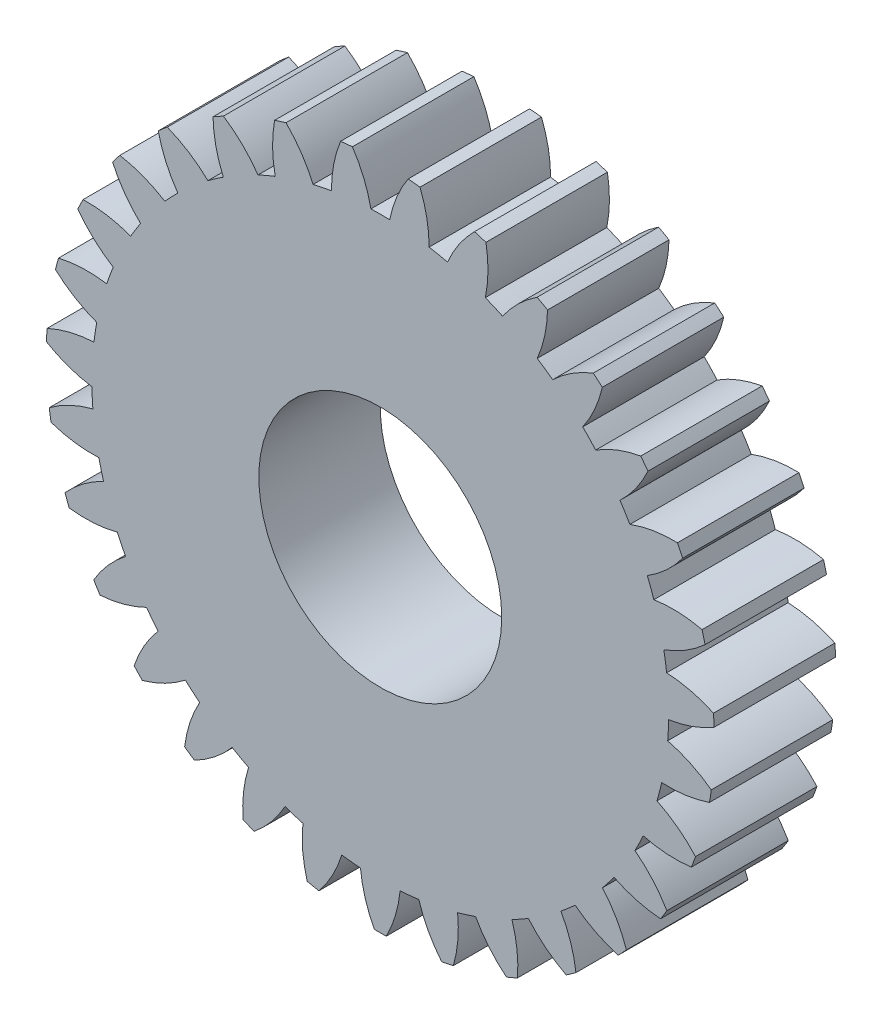
from build123d import *

# Parameters (mm, degrees)
SKETCH_1_R      = 3
EXTRUDE_1_DEPTH = 3


with BuildPart() as part:
    # 草图1 → 凸台-拉伸1 (new body)
    with BuildSketch(Plane.XY):
        with BuildLine():
            ThreePointArc((7.122832774, -0.128954515), (7.703578069, 0.016376255), (8.245560205, 0.270623168))
            ThreePointArc((8.245560205, 0.270623168), (8.239411184, 0.417855643), (8.230633394, 0.564954801))
            ThreePointArc((8.230633394, 0.564954801), (7.665710259, 0.763065833), (7.073241711, 0.848897931))
            ThreePointArc((7.073241711, 0.848897931), (7.041848343, 1.078771487), (7.002986322, 1.307500888))
            ThreePointArc((7.002986322, 1.307500888), (7.542588857, 1.566759896), (8.02229706, 1.924902563))
            ThreePointArc((8.02229706, 1.924902563), (7.986636231, 2.067883391), (7.94842728, 2.210204465))
            ThreePointArc((7.94842728, 2.210204465), (7.355188697, 2.290541961), (6.757570141, 2.255354029))
            ThreePointArc((6.757570141, 2.255354029), (6.680546189, 2.474202621), (6.596436787, 2.690427051))
            ThreePointArc((6.596436787, 2.690427051), (7.072805172, 3.053000204), (7.470600131, 3.50037622))
            ThreePointArc((7.470600131, 3.50037622), (7.406887451, 3.63325175), (7.340811619, 3.764968098))
            ThreePointArc((7.340811619, 3.764968098), (6.743544845, 3.724243032), (6.165242855, 3.569475668))
            ThreePointArc((6.165242855, 3.569475668), (6.04574169, 3.76833961), (5.919828355, 3.963206814))
            ThreePointArc((5.919828355, 3.963206814), (6.313460012, 4.414250324), (6.613055954, 4.932544064))
            ThreePointArc((6.613055954, 4.932544064), (6.52389983, 5.049874356), (6.432662267, 5.165593495))
            ThreePointArc((6.432662267, 5.165593495), (5.855819475, 5.005473156), (5.320509802, 4.737462554))
            ThreePointArc((5.320509802, 4.737462554), (5.163423816, 4.908200331), (5.000861454, 5.073732425))
            ThreePointArc((5.000861454, 5.073732425), (5.295641057, 5.594780518), (5.48477249, 6.162772974))
            ThreePointArc((5.48477249, 6.162772974), (5.373822982, 6.259754512), (5.261158967, 6.354738887))
            ThreePointArc((5.261158967, 6.354738887), (4.728356168, 6.081778621), (4.257954452, 5.711497166))
            ThreePointArc((4.257954452, 5.711497166), (4.069714764, 5.847118755), (3.877158698, 5.976538834))
            ThreePointArc((3.877158698, 5.976538834), (4.061017935, 6.54625974), (4.131941796, 7.140697235))
            ThreePointArc((4.131941796, 7.140697235), (4.003741191, 7.213359583), (3.8742632, 7.283720523))
            ThreePointArc((3.8742632, 7.283720523), (3.407313403, 6.909095354), (3.021077947, 6.451702414))
            ThreePointArc((3.021077947, 6.451702414), (2.809391112, 6.54665545), (2.594724609, 6.634665041))
            ThreePointArc((2.594724609, 6.634665041), (2.660136261, 7.229734318), (2.609948919, 7.826280511))
            ThreePointArc((2.609948919, 7.826280511), (2.469745765, 7.871648865), (2.328754643, 7.914505785))
            ThreePointArc((2.328754643, 7.914505785), (1.946774828, 7.453552912), (1.660518156, 6.927774206))
            ThreePointArc((1.660518156, 6.927774206), (1.434050657, 6.978171301), (1.20606219, 7.021167281))
            ThreePointArc((1.20606219, 7.021167281), (1.150348297, 7.617222725), (0.981104426, 8.191454944))
            ThreePointArc((0.981104426, 8.191454944), (0.834638656, 8.207671918), (0.687906597, 8.221270249))
            ThreePointArc((0.687906597, 8.221270249), (0.406535062, 7.692861138), (0.231976557, 7.120222109))
            ThreePointArc((0.231976557, 7.120222109), (0, 7.124), (-0.231976557, 7.120222109))
            ThreePointArc((-0.231976557, 7.120222109), (-0.406535062, 7.692861138), (-0.687906597, 8.221270249))
            ThreePointArc((-0.687906597, 8.221270249), (-0.834638656, 8.207671918), (-0.981104426, 8.191454944))
            ThreePointArc((-0.981104426, 8.191454944), (-1.150348297, 7.617222725), (-1.20606219, 7.021167281))
            ThreePointArc((-1.20606219, 7.021167281), (-1.434050657, 6.978171301), (-1.660518156, 6.927774206))
            ThreePointArc((-1.660518156, 6.927774206), (-1.946774828, 7.453552912), (-2.328754643, 7.914505785))
            ThreePointArc((-2.328754643, 7.914505785), (-2.469745765, 7.871648865), (-2.609948919, 7.826280511))
            ThreePointArc((-2.609948919, 7.826280511), (-2.660136261, 7.229734318), (-2.594724609, 6.634665041))
            ThreePointArc((-2.594724609, 6.634665041), (-2.809391112, 6.54665545), (-3.021077947, 6.451702414))
            ThreePointArc((-3.021077947, 6.451702414), (-3.407313403, 6.909095354), (-3.8742632, 7.283720523))
            ThreePointArc((-3.8742632, 7.283720523), (-4.003741191, 7.213359583), (-4.131941796, 7.140697235))
            ThreePointArc((-4.131941796, 7.140697235), (-4.061017935, 6.54625974), (-3.877158698, 5.976538834))
            ThreePointArc((-3.877158698, 5.976538834), (-4.069714764, 5.847118755), (-4.257954452, 5.711497166))
            ThreePointArc((-4.257954452, 5.711497166), (-4.728356168, 6.081778621), (-5.261158967, 6.354738887))
            ThreePointArc((-5.261158967, 6.354738887), (-5.373822982, 6.259754512), (-5.48477249, 6.162772974))
            ThreePointArc((-5.48477249, 6.162772974), (-5.295641057, 5.594780518), (-5.000861454, 5.073732425))
            ThreePointArc((-5.000861454, 5.073732425), (-5.163423816, 4.908200331), (-5.320509802, 4.737462554))
            ThreePointArc((-5.320509802, 4.737462554), (-5.855819475, 5.005473156), (-6.432662267, 5.165593495))
            ThreePointArc((-6.432662267, 5.165593495), (-6.52389983, 5.049874356), (-6.613055954, 4.932544064))
            ThreePointArc((-6.613055954, 4.932544064), (-6.313460012, 4.414250324), (-5.919828355, 3.963206814))
            ThreePointArc((-5.919828355, 3.963206814), (-6.04574169, 3.76833961), (-6.165242855, 3.569475668))
            ThreePointArc((-6.165242855, 3.569475668), (-6.743544845, 3.724243032), (-7.340811619, 3.764968098))
            ThreePointArc((-7.340811619, 3.764968098), (-7.406887451, 3.63325175), (-7.470600131, 3.50037622))
            ThreePointArc((-7.470600131, 3.50037622), (-7.072805172, 3.053000204), (-6.596436787, 2.690427051))
            ThreePointArc((-6.596436787, 2.690427051), (-6.680546189, 2.474202621), (-6.757570141, 2.255354029))
            ThreePointArc((-6.757570141, 2.255354029), (-7.355188697, 2.290541961), (-7.94842728, 2.210204465))
            ThreePointArc((-7.94842728, 2.210204465), (-7.986636231, 2.067883391), (-8.02229706, 1.924902563))
            ThreePointArc((-8.02229706, 1.924902563), (-7.542588857, 1.566759896), (-7.002986322, 1.307500888))
            ThreePointArc((-7.002986322, 1.307500888), (-7.041848343, 1.078771487), (-7.073241711, 0.848897931))
            ThreePointArc((-7.073241711, 0.848897931), (-7.665710259, 0.763065833), (-8.230633394, 0.564954801))
            ThreePointArc((-8.230633394, 0.564954801), (-8.239411184, 0.417855643), (-8.245560205, 0.270623168))
            ThreePointArc((-8.245560205, 0.270623168), (-7.703578069, 0.016376255), (-7.122832774, -0.128954515))
            ThreePointArc((-7.122832774, -0.128954515), (-7.114856397, -0.360824679), (-7.099333935, -0.592312149))
            ThreePointArc((-7.099333935, -0.592312149), (-7.662396743, -0.7956503), (-8.175876411, -1.103424178))
            ThreePointArc((-8.175876411, -1.103424178), (-8.154863676, -1.249279164), (-8.131249147, -1.39473557))
            ThreePointArc((-8.131249147, -1.39473557), (-7.549181889, -1.534677833), (-6.951069616, -1.560130505))
            ThreePointArc((-6.951069616, -1.560130505), (-6.896581395, -1.78564864), (-6.834778593, -2.009272899))
            ThreePointArc((-6.834778593, -2.009272899), (-7.345383803, -2.321792416), (-7.786398086, -2.726628842))
            ThreePointArc((-7.786398086, -2.726628842), (-7.73645509, -2.865268336), (-7.684043793, -3.002993671))
            ThreePointArc((-7.684043793, -3.002993671), (-7.085721316, -3.02290203), (-6.494728851, -2.927434568))
            ThreePointArc((-6.494728851, -2.927434568), (-6.39595954, -3.137367936), (-6.290406613, -3.34397378))
            ThreePointArc((-6.290406613, -3.34397378), (-6.727649988, -3.752880078), (-7.078143709, -4.238205001))
            ThreePointArc((-7.078143709, -4.238205001), (-7.001315124, -4.363953085), (-6.922252783, -4.488308858))
            ThreePointArc((-6.922252783, -4.488308858), (-6.332170479, -4.387368262), (-5.772493124, -4.174889117))
            ThreePointArc((-5.772493124, -4.174889117), (-5.63348635, -4.36064302), (-5.488504647, -4.541771983))
            ThreePointArc((-5.488504647, -4.541771983), (-5.834485392, -5.030324389), (-6.080109297, -5.57626855))
            ThreePointArc((-6.080109297, -5.57626855), (-5.979540495, -5.683977082), (-5.877063931, -5.789872153))
            ThreePointArc((-5.877063931, -5.789872153), (-5.319379839, -5.572215122), (-4.813930849, -5.251423214))
            ThreePointArc((-4.813930849, -5.251423214), (-4.640377567, -5.405392866), (-4.461902656, -5.553629506))
            ThreePointArc((-4.461902656, -5.553629506), (-4.702456278, -6.101826628), (-4.833154496, -6.686039008))
            ThreePointArc((-4.833154496, -6.686039008), (-4.712962775, -6.77129839), (-4.591267391, -6.854397402))
            ThreePointArc((-4.591267391, -6.854397402), (-4.088813164, -6.528934841), (-3.658285681, -6.112963429))
            ThreePointArc((-3.658285681, -6.112963429), (-3.457291181, -6.228845293), (-3.252629845, -6.338120785))
            ThreePointArc((-3.252629845, -6.338120785), (-3.377908052, -6.923519368), (-3.388329782, -7.522082244))
            ThreePointArc((-3.388329782, -7.522082244), (-3.253435805, -7.581401946), (-3.117503825, -7.638302815))
            ThreePointArc((-3.117503825, -7.638302815), (-2.690849997, -7.2183592), (-2.352869866, -6.724238202))
            ThreePointArc((-2.352869866, -6.724238202), (-2.132662888, -6.797288063), (-1.910193987, -6.863128655))
            ThreePointArc((-1.910193987, -6.863128655), (-1.915067873, -7.461762412), (-1.804786448, -8.05017055))
            ThreePointArc((-1.804786448, -8.05017055), (-1.660712791, -8.081122015), (-1.516109286, -8.109495214))
            ThreePointArc((-1.516109286, -8.109495214), (-1.182723115, -7.612263085), (-0.951127283, -7.060221873))
            ThreePointArc((-0.951127283, -7.060221873), (-0.720723126, -7.08744906), (-0.489554563, -7.107159231))
            ThreePointArc((-0.489554563, -7.107159231), (-0.37382459, -7.694520025), (-0.147354945, -8.248683927))
            ThreePointArc((-0.147354945, -8.248683927), (0, -8.25), (0.147354945, -8.248683927))
            ThreePointArc((0.147354945, -8.248683927), (0.37382459, -7.694520025), (0.489554563, -7.107159231))
            ThreePointArc((0.489554563, -7.107159231), (0.720723126, -7.08744906), (0.951127283, -7.060221873))
            ThreePointArc((0.951127283, -7.060221873), (1.182723115, -7.612263085), (1.516109286, -8.109495214))
            ThreePointArc((1.516109286, -8.109495214), (1.660712791, -8.081122015), (1.804786448, -8.05017055))
            ThreePointArc((1.804786448, -8.05017055), (1.915067873, -7.461762412), (1.910193987, -6.863128655))
            ThreePointArc((1.910193987, -6.863128655), (2.132662888, -6.797288063), (2.352869866, -6.724238202))
            ThreePointArc((2.352869866, -6.724238202), (2.690849997, -7.2183592), (3.117503825, -7.638302815))
            ThreePointArc((3.117503825, -7.638302815), (3.253435805, -7.581401946), (3.388329782, -7.522082244))
            ThreePointArc((3.388329782, -7.522082244), (3.377908052, -6.923519368), (3.252629845, -6.338120785))
            ThreePointArc((3.252629845, -6.338120785), (3.457291181, -6.228845293), (3.658285681, -6.112963429))
            ThreePointArc((3.658285681, -6.112963429), (4.088813164, -6.528934841), (4.591267391, -6.854397402))
            ThreePointArc((4.591267391, -6.854397402), (4.712962775, -6.77129839), (4.833154496, -6.686039008))
            ThreePointArc((4.833154496, -6.686039008), (4.702456278, -6.101826628), (4.461902656, -5.553629506))
            ThreePointArc((4.461902656, -5.553629506), (4.640377567, -5.405392866), (4.813930849, -5.251423214))
            ThreePointArc((4.813930849, -5.251423214), (5.319379839, -5.572215122), (5.877063931, -5.789872153))
            ThreePointArc((5.877063931, -5.789872153), (5.979540495, -5.683977082), (6.080109297, -5.57626855))
            ThreePointArc((6.080109297, -5.57626855), (5.834485392, -5.030324389), (5.488504647, -4.541771983))
            ThreePointArc((5.488504647, -4.541771983), (5.63348635, -4.36064302), (5.772493124, -4.174889117))
            ThreePointArc((5.772493124, -4.174889117), (6.332170479, -4.387368262), (6.922252783, -4.488308858))
            ThreePointArc((6.922252783, -4.488308858), (7.001315124, -4.363953085), (7.078143709, -4.238205001))
            ThreePointArc((7.078143709, -4.238205001), (6.727649988, -3.752880078), (6.290406613, -3.34397378))
            ThreePointArc((6.290406613, -3.34397378), (6.39595954, -3.137367936), (6.494728851, -2.927434568))
            ThreePointArc((6.494728851, -2.927434568), (7.085721316, -3.02290203), (7.684043793, -3.002993671))
            ThreePointArc((7.684043793, -3.002993671), (7.73645509, -2.865268336), (7.786398086, -2.726628842))
            ThreePointArc((7.786398086, -2.726628842), (7.345383803, -2.321792416), (6.834778593, -2.009272899))
            ThreePointArc((6.834778593, -2.009272899), (6.896581395, -1.78564864), (6.951069616, -1.560130505))
            ThreePointArc((6.951069616, -1.560130505), (7.549181889, -1.534677833), (8.131249147, -1.39473557))
            ThreePointArc((8.131249147, -1.39473557), (8.154863676, -1.249279164), (8.175876411, -1.103424178))
            ThreePointArc((8.175876411, -1.103424178), (7.662396743, -0.7956503), (7.099333935, -0.592312149))
            ThreePointArc((7.099333935, -0.592312149), (7.114856397, -0.360824679), (7.122832774, -0.128954515))
        make_face()
        Circle(SKETCH_1_R, mode=Mode.SUBTRACT)
    extrude(amount=EXTRUDE_1_DEPTH)


solid = part.part
